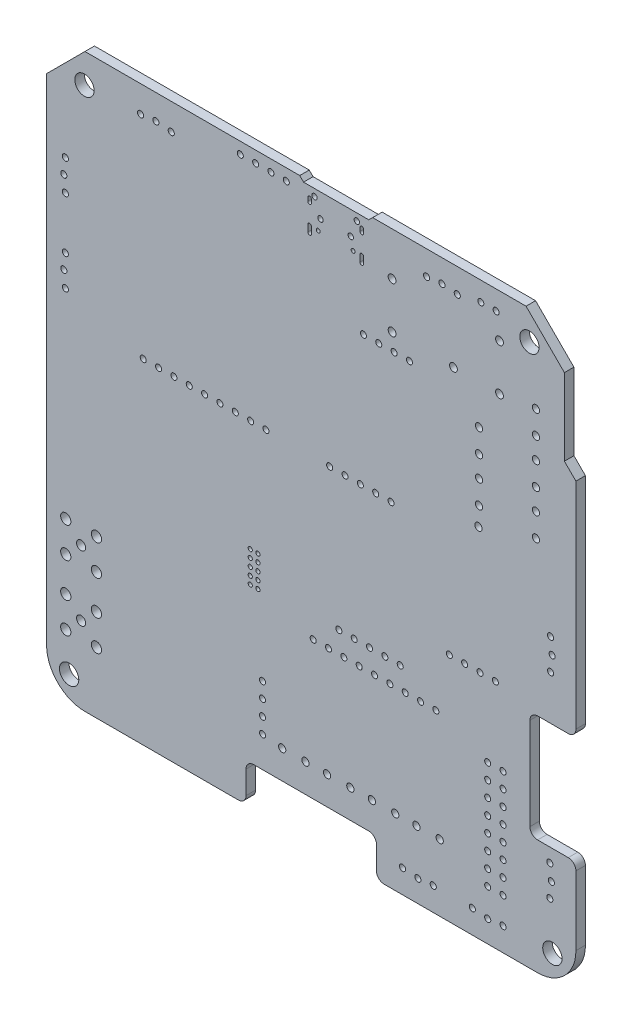
from build123d import *

# Parameters (mm, degrees)
SKETCH1_R           = 0.508
SKETCH1_R_2         = 1.6
SKETCH1_R_3         = 0.5
SKETCH1_R_4         = 0.6477
SKETCH1_R_5         = 0.6
SKETCH1_R_6         = 0.45
SKETCH1_R_7         = 0.4445
SKETCH1_R_8         = 0.325
SKETCH1_R_9         = 0.85
SKETCH1_R_10        = 0.75
SKETCH1_R_11        = 0.35
BOSS_EXTRUDE1_DEPTH = 1.5748


with BuildPart() as part:
    # Sketch1 → Boss-Extrude1 (new body)
    with BuildSketch(Plane.XY.offset(1.5748)):
        with BuildLine():
            Line((-37.465, -47.3075), (-12.065, -47.3075))
            ThreePointArc((-12.065, -47.3075), (-11.166974388, -46.935525612), (-10.795, -46.0375))
            Line((-10.795, -46.0375), (-10.795, -42.2275))
            ThreePointArc((-10.795, -42.2275), (-10.423025612, -41.329474388), (-9.525, -40.9575))
            Line((-9.525, -40.9575), (9.525, -40.9575))
            ThreePointArc((9.525, -40.9575), (10.423025612, -41.329474388), (10.795, -42.2275))
            Line((10.795, -42.2275), (10.795, -46.0375))
            ThreePointArc((10.795, -46.0375), (11.166974388, -46.935525612), (12.065, -47.3075))
            Line((12.065, -47.3075), (37.465, -47.3075))
            ThreePointArc((37.465, -47.3075), (41.955128061, -45.447628061), (43.815, -40.9575))
            Line((43.815, -40.9575), (43.815, -29.5275))
            ThreePointArc((43.815, -29.5275), (43.443025612, -28.629474388), (42.545, -28.2575))
            Line((42.545, -28.2575), (37.465, -28.2575))
            ThreePointArc((37.465, -28.2575), (36.566974388, -27.885525612), (36.195, -26.9875))
            Line((36.195, -26.9875), (36.195, -11.7475))
            ThreePointArc((36.195, -11.7475), (36.566974388, -10.849474388), (37.465, -10.4775))
            Line((37.465, -10.4775), (42.545, -10.4775))
            ThreePointArc((42.545, -10.4775), (43.443025612, -10.105525612), (43.815, -9.2075))
            Line((43.815, -9.2075), (43.815, 26.3525))
            Line((43.815, 26.3525), (41.91, 28.2575))
            Line((41.91, 28.2575), (41.91, 40.9575))
            Line((41.91, 40.9575), (35.56, 47.3075))
            Line((35.56, 47.3075), (10.16, 47.3075))
            Line((10.16, 47.3075), (9.525, 46.6725))
            Line((9.525, 46.6725), (-1.27, 46.6725))
            Line((-1.27, 46.6725), (-1.905, 47.3075))
            Line((-1.905, 47.3075), (-37.465, 47.3075))
            Line((-37.465, 47.3075), (-43.815, 40.9575))
            Line((-43.815, 40.9575), (-43.815, -40.9575))
            ThreePointArc((-43.815, -40.9575), (-41.955128061, -45.447628061), (-37.465, -47.3075))
        make_face()
        with Locations(Location((39.497, -35.6235, 0), (0, 0, 180))):
            Circle(SKETCH1_R, mode=Mode.SUBTRACT)
        with Locations(Location((39.9161, -43.2816, 0), (0, 0, 180))):
            Circle(SKETCH1_R_2, mode=Mode.SUBTRACT)
        with Locations(Location((39.751, -33.0835, 0), (0, 0, 180))):
            Circle(SKETCH1_R, mode=Mode.SUBTRACT)
        with Locations(Location((39.497, -30.5435, 0), (0, 0, 180))):
            Circle(SKETCH1_R, mode=Mode.SUBTRACT)
        with Locations(Location((39.624, -3.1115, 0), (0, 0, 180))):
            Circle(SKETCH1_R, mode=Mode.SUBTRACT)
        with Locations(Location((39.878, -0.5715, 0), (0, 0, 180))):
            Circle(SKETCH1_R, mode=Mode.SUBTRACT)
        with Locations(Location((39.624, 1.9685, 0), (0, 0, 180))):
            Circle(SKETCH1_R, mode=Mode.SUBTRACT)
        with Locations(Location((-40.0839, -43.2816, 0), (0, 0, 180))):
            Circle(SKETCH1_R_2, mode=Mode.SUBTRACT)
        with Locations(Location((15.113, -43.434, 0), (0, 0, 180))):
            Circle(SKETCH1_R, mode=Mode.SUBTRACT)
        with Locations(Location((20.193, -43.434, 0), (0, 0, 180))):
            Circle(SKETCH1_R, mode=Mode.SUBTRACT)
        with Locations(Location((17.653, -43.688, 0), (0, 0, 180))):
            Circle(SKETCH1_R, mode=Mode.SUBTRACT)
        with Locations(Location((26.67, -43.434, 0), (0, 0, 180))):
            Circle(SKETCH1_R, mode=Mode.SUBTRACT)
        with Locations(Location((29.21, -39.0525, 0), (0, 0, 180))):
            Circle(SKETCH1_R_3, mode=Mode.SUBTRACT)
        with Locations(Location((31.75, -39.0525, 0), (0, 0, 180))):
            Circle(SKETCH1_R_3, mode=Mode.SUBTRACT)
        with Locations(Location((31.75, -43.434, 0), (0, 0, 180))):
            Circle(SKETCH1_R, mode=Mode.SUBTRACT)
        with Locations(Location((29.21, -43.688, 0), (0, 0, 180))):
            Circle(SKETCH1_R, mode=Mode.SUBTRACT)
        with Locations(Location((-37.5439, 42.4434, 0), (0, 0, 180))):
            Circle(SKETCH1_R_2, mode=Mode.SUBTRACT)
        with Locations(Location((-28.2575, 42.926, 0), (0, 0, 180))):
            Circle(SKETCH1_R, mode=Mode.SUBTRACT)
        with Locations(Location((-11.7475, 45.4025, 0), (0, 0, 180))):
            Circle(SKETCH1_R_3, mode=Mode.SUBTRACT)
        with Locations(Location((-23.1775, 42.926, 0), (0, 0, 180))):
            Circle(SKETCH1_R, mode=Mode.SUBTRACT)
        with Locations(Location((-25.7175, 43.18, 0), (0, 0, 180))):
            Circle(SKETCH1_R, mode=Mode.SUBTRACT)
        with Locations(Location((36.1161, 42.4434, 0), (0, 0, 180))):
            Circle(SKETCH1_R_2, mode=Mode.SUBTRACT)
        with Locations(Location((31.1623, 40.147404, 0), (0, 0, 180))):
            Circle(SKETCH1_R_4, mode=Mode.SUBTRACT)
        with Locations(Location((30.607, 44.1325, 0), (0, 0, 180))):
            Circle(SKETCH1_R_3, mode=Mode.SUBTRACT)
        with Locations(Location((28.067, 44.1325, 0), (0, 0, 180))):
            Circle(SKETCH1_R_3, mode=Mode.SUBTRACT)
        with Locations(Location((31.1623, 32.527404, 0), (0, 0, 180))):
            Circle(SKETCH1_R_4, mode=Mode.SUBTRACT)
        with Locations(Location((37.1981, 33.407404, 0), (0, 0, 180))):
            Circle(SKETCH1_R_5, mode=Mode.SUBTRACT)
        with Locations(Location((-9.2075, 45.4025, 0), (0, 0, 180))):
            Circle(SKETCH1_R_3, mode=Mode.SUBTRACT)
        with Locations(Location((19.0941, 43.301404, 0), (0, 0, 180))):
            Circle(SKETCH1_R, mode=Mode.SUBTRACT)
        with Locations(Location((24.1741, 43.301404, 0), (0, 0, 180))):
            Circle(SKETCH1_R, mode=Mode.SUBTRACT)
        with Locations(Location((21.6341, 43.555404, 0), (0, 0, 180))):
            Circle(SKETCH1_R, mode=Mode.SUBTRACT)
        with Locations(Location((23.5423, 32.527404, 0), (0, 0, 180))):
            Circle(SKETCH1_R_4, mode=Mode.SUBTRACT)
        with Locations(Location((6.5386, 42.8041, 0), (0, 0, 180))):
            Circle(SKETCH1_R_6, mode=Mode.SUBTRACT)
        with Locations(Location((7.5386, 45.5041, 0), (0, 0, 180))):
            Circle(SKETCH1_R_7, mode=Mode.SUBTRACT)
        with Locations(Location((13.3823, 40.147404, 0), (0, 0, 180))):
            Circle(SKETCH1_R_4, mode=Mode.SUBTRACT)
        with Locations(Location((6.9366, 40.9257, 0), (0, 0, 180))):
            Circle(SKETCH1_R_8, mode=Mode.SUBTRACT)
        with Locations(Location((13.3823, 32.527404, 0), (0, 0, 180))):
            Circle(SKETCH1_R_4, mode=Mode.SUBTRACT)
        with Locations(Location((1.1566, 40.9257, 0), (0, 0, 180))):
            Circle(SKETCH1_R_8, mode=Mode.SUBTRACT)
        with Locations(Location((0.5386, 45.5041, 0), (0, 0, 180))):
            Circle(SKETCH1_R_7, mode=Mode.SUBTRACT)
        with Locations(Location((1.5386, 42.8041, 0), (0, 0, 180))):
            Circle(SKETCH1_R_6, mode=Mode.SUBTRACT)
        with Locations(Location((-4.1275, 45.4025, 0), (0, 0, 180))):
            Circle(SKETCH1_R_3, mode=Mode.SUBTRACT)
        with Locations(Location((-6.6675, 45.4025, 0), (0, 0, 180))):
            Circle(SKETCH1_R_3, mode=Mode.SUBTRACT)
        with Locations(Location((-40.64, -32.0675, 0), (0, 0, 180))):
            Circle(SKETCH1_R_9, mode=Mode.SUBTRACT)
        with Locations(Location((-38.1, -34.6075, 0), (0, 0, 180))):
            Circle(SKETCH1_R_10, mode=Mode.SUBTRACT)
        with Locations(Location((-40.64, -37.1475, 0), (0, 0, 180))):
            Circle(SKETCH1_R_9, mode=Mode.SUBTRACT)
        with Locations(Location((31.75, -28.8925, 0), (0, 0, 180))):
            Circle(SKETCH1_R_3, mode=Mode.SUBTRACT)
        with Locations(Location((-8.0645, -28.2575, 0), (0, 0, 180))):
            Circle(SKETCH1_R_3, mode=Mode.SUBTRACT)
        with Locations(Location((29.21, -28.8925, 0), (0, 0, 180))):
            Circle(SKETCH1_R_3, mode=Mode.SUBTRACT)
        with Locations(Location((31.75, -36.5125, 0), (0, 0, 180))):
            Circle(SKETCH1_R_3, mode=Mode.SUBTRACT)
        with Locations(Location((-8.0645, -33.3375, 0), (0, 0, 180))):
            Circle(SKETCH1_R_3, mode=Mode.SUBTRACT)
        with Locations(Location((31.75, -33.9725, 0), (0, 0, 180))):
            Circle(SKETCH1_R_3, mode=Mode.SUBTRACT)
        with Locations(Location((-8.0645, -30.7975, 0), (0, 0, 180))):
            Circle(SKETCH1_R_3, mode=Mode.SUBTRACT)
        with Locations(Location((29.21, -31.4325, 0), (0, 0, 180))):
            Circle(SKETCH1_R_3, mode=Mode.SUBTRACT)
        with Locations(Location((31.75, -31.4325, 0), (0, 0, 180))):
            Circle(SKETCH1_R_3, mode=Mode.SUBTRACT)
        with Locations(Location((-35.56, -32.0675, 0), (0, 0, 180))):
            Circle(SKETCH1_R_9, mode=Mode.SUBTRACT)
        with Locations(Location((-35.56, -37.1475, 0), (0, 0, 180))):
            Circle(SKETCH1_R_9, mode=Mode.SUBTRACT)
        with Locations(Location((13.9013, -36.2585, 0), (0, 0, 180))):
            Circle(SKETCH1_R_5, mode=Mode.SUBTRACT)
        with Locations(Location((21.2673, -36.2585, 0), (0, 0, 180))):
            Circle(SKETCH1_R_5, mode=Mode.SUBTRACT)
        with Locations(Location((17.4117, -36.2585, 0), (0, 0, 180))):
            Circle(SKETCH1_R_5, mode=Mode.SUBTRACT)
        with Locations(Location((29.21, -36.5125, 0), (0, 0, 180))):
            Circle(SKETCH1_R_3, mode=Mode.SUBTRACT)
        with Locations(Location((29.21, -33.9725, 0), (0, 0, 180))):
            Circle(SKETCH1_R_3, mode=Mode.SUBTRACT)
        with Locations(Location((6.4718, -36.2585, 0), (0, 0, 180))):
            Circle(SKETCH1_R_5, mode=Mode.SUBTRACT)
        with Locations(Location((10.0457, -36.2585, 0), (0, 0, 180))):
            Circle(SKETCH1_R_5, mode=Mode.SUBTRACT)
        with Locations(Location((-0.9577, -36.2585, 0), (0, 0, 180))):
            Circle(SKETCH1_R_5, mode=Mode.SUBTRACT)
        with Locations(Location((2.6162, -36.2585, 0), (0, 0, 180))):
            Circle(SKETCH1_R_5, mode=Mode.SUBTRACT)
        with Locations(Location((-4.8133, -36.2585, 0), (0, 0, 180))):
            Circle(SKETCH1_R_5, mode=Mode.SUBTRACT)
        with Locations(Location((-8.0645, -35.8775, 0), (0, 0, 180))):
            Circle(SKETCH1_R_3, mode=Mode.SUBTRACT)
        with Locations(Location((37.1981, 29.551804, 0), (0, 0, 180))):
            Circle(SKETCH1_R_5, mode=Mode.SUBTRACT)
        with Locations(Location((30.48, -9.017, 0), (0, 0, 180))):
            Circle(SKETCH1_R_3, mode=Mode.SUBTRACT)
        with Locations(Location((31.75, -21.2725, 0), (0, 0, 180))):
            Circle(SKETCH1_R_3, mode=Mode.SUBTRACT)
        with Locations(Location((31.75, -23.8125, 0), (0, 0, 180))):
            Circle(SKETCH1_R_3, mode=Mode.SUBTRACT)
        with Locations(Location((31.75, -26.3525, 0), (0, 0, 180))):
            Circle(SKETCH1_R_3, mode=Mode.SUBTRACT)
        with Locations(Location((37.1981, 18.696204, 0), (0, 0, 180))):
            Circle(SKETCH1_R_5, mode=Mode.SUBTRACT)
        with Locations(Location((37.1981, 14.840604, 0), (0, 0, 180))):
            Circle(SKETCH1_R_5, mode=Mode.SUBTRACT)
        with Locations(Location((37.1981, 26.051804, 0), (0, 0, 180))):
            Circle(SKETCH1_R_5, mode=Mode.SUBTRACT)
        with Locations(Location((37.1981, 22.196204, 0), (0, 0, 180))):
            Circle(SKETCH1_R_5, mode=Mode.SUBTRACT)
        with Locations(Location((13.716, 29.7815, 0), (0, 0, 180))):
            Circle(SKETCH1_R_3, mode=Mode.SUBTRACT)
        with Locations(Location((16.256, 29.7815, 0), (0, 0, 180))):
            Circle(SKETCH1_R_3, mode=Mode.SUBTRACT)
        with Locations(Location((-40.7035, 30.48, 0), (0, 0, 180))):
            Circle(SKETCH1_R, mode=Mode.SUBTRACT)
        with Locations(Location((-40.9575, 27.94, 0), (0, 0, 180))):
            Circle(SKETCH1_R, mode=Mode.SUBTRACT)
        with Locations(Location((8.636, 29.7815, 0), (0, 0, 180))):
            Circle(SKETCH1_R_3, mode=Mode.SUBTRACT)
        with Locations(Location((11.176, 29.7815, 0), (0, 0, 180))):
            Circle(SKETCH1_R_3, mode=Mode.SUBTRACT)
        with Locations(Location((-40.7035, 25.4, 0), (0, 0, 180))):
            Circle(SKETCH1_R, mode=Mode.SUBTRACT)
        with Locations(Location((-40.9575, 14.2875, 0), (0, 0, 180))):
            Circle(SKETCH1_R, mode=Mode.SUBTRACT)
        with Locations(Location((-40.7035, 16.8275, 0), (0, 0, 180))):
            Circle(SKETCH1_R, mode=Mode.SUBTRACT)
        with Locations(Location((-40.7035, 11.7475, 0), (0, 0, 180))):
            Circle(SKETCH1_R, mode=Mode.SUBTRACT)
        with Locations(Location((3.048, 8.0645, 0), (0, 0, 180))):
            Circle(SKETCH1_R_3, mode=Mode.SUBTRACT)
        with Locations(Location((2.8575, -18.0975, 0), (0, 0, 180))):
            Circle(SKETCH1_R_3, mode=Mode.SUBTRACT)
        with Locations(Location((0.3175, -18.0975, 0), (0, 0, 180))):
            Circle(SKETCH1_R_3, mode=Mode.SUBTRACT)
        with Locations(Location((4.572, -14.5923, 0), (0, 0, 180))):
            Circle(SKETCH1_R_3, mode=Mode.SUBTRACT)
        with Locations(Location((-38.1, -23.8125, 0), (0, 0, 180))):
            Circle(SKETCH1_R_10, mode=Mode.SUBTRACT)
        with Locations(Location((-40.64, -26.3525, 0), (0, 0, 180))):
            Circle(SKETCH1_R_9, mode=Mode.SUBTRACT)
        with Locations(Location((-35.56, -26.3525, 0), (0, 0, 180))):
            Circle(SKETCH1_R_9, mode=Mode.SUBTRACT)
        with Locations(Location((-8.8265, -15.4305, 0), (0, 0, 180))):
            Circle(SKETCH1_R_11, mode=Mode.SUBTRACT)
        with Locations(Location((-10.0965, -15.4305, 0), (0, 0, 180))):
            Circle(SKETCH1_R_11, mode=Mode.SUBTRACT)
        with Locations(Location((-10.0965, -10.3505, 0), (0, 0, 180))):
            Circle(SKETCH1_R_11, mode=Mode.SUBTRACT)
        with Locations(Location((-10.0965, -11.6205, 0), (0, 0, 180))):
            Circle(SKETCH1_R_11, mode=Mode.SUBTRACT)
        with Locations(Location((-8.8265, -11.6205, 0), (0, 0, 180))):
            Circle(SKETCH1_R_11, mode=Mode.SUBTRACT)
        with Locations(Location((-8.8265, -10.3505, 0), (0, 0, 180))):
            Circle(SKETCH1_R_11, mode=Mode.SUBTRACT)
        with Locations(Location((-10.0965, -12.8905, 0), (0, 0, 180))):
            Circle(SKETCH1_R_11, mode=Mode.SUBTRACT)
        with Locations(Location((-8.8265, -12.8905, 0), (0, 0, 180))):
            Circle(SKETCH1_R_11, mode=Mode.SUBTRACT)
        with Locations(Location((-8.8265, -14.1605, 0), (0, 0, 180))):
            Circle(SKETCH1_R_11, mode=Mode.SUBTRACT)
        with Locations(Location((-10.0965, -14.1605, 0), (0, 0, 180))):
            Circle(SKETCH1_R_11, mode=Mode.SUBTRACT)
        with Locations(Location((-12.573, 8.0645, 0), (0, 0, 180))):
            Circle(SKETCH1_R_3, mode=Mode.SUBTRACT)
        with Locations(Location((-15.113, 8.0645, 0), (0, 0, 180))):
            Circle(SKETCH1_R_3, mode=Mode.SUBTRACT)
        with Locations(Location((-10.033, 8.0645, 0), (0, 0, 180))):
            Circle(SKETCH1_R_3, mode=Mode.SUBTRACT)
        with Locations(Location((-7.493, 8.0645, 0), (0, 0, 180))):
            Circle(SKETCH1_R_3, mode=Mode.SUBTRACT)
        with Locations(Location((-27.813, 8.0645, 0), (0, 0, 180))):
            Circle(SKETCH1_R_3, mode=Mode.SUBTRACT)
        with Locations(Location((-22.733, 8.0645, 0), (0, 0, 180))):
            Circle(SKETCH1_R_3, mode=Mode.SUBTRACT)
        with Locations(Location((-25.273, 8.0645, 0), (0, 0, 180))):
            Circle(SKETCH1_R_3, mode=Mode.SUBTRACT)
        with Locations(Location((-20.193, 8.0645, 0), (0, 0, 180))):
            Circle(SKETCH1_R_3, mode=Mode.SUBTRACT)
        with Locations(Location((-17.653, 8.0645, 0), (0, 0, 180))):
            Circle(SKETCH1_R_3, mode=Mode.SUBTRACT)
        with Locations(Location((-35.56, -21.2725, 0), (0, 0, 180))):
            Circle(SKETCH1_R_9, mode=Mode.SUBTRACT)
        with Locations(Location((-40.64, -21.2725, 0), (0, 0, 180))):
            Circle(SKETCH1_R_9, mode=Mode.SUBTRACT)
        with Locations(Location((7.9375, -18.0975, 0), (0, 0, 180))):
            Circle(SKETCH1_R_3, mode=Mode.SUBTRACT)
        with Locations(Location((10.4775, -18.0975, 0), (0, 0, 180))):
            Circle(SKETCH1_R_3, mode=Mode.SUBTRACT)
        with Locations(Location((5.3975, -18.0975, 0), (0, 0, 180))):
            Circle(SKETCH1_R_3, mode=Mode.SUBTRACT)
        with Locations(Location((7.112, -14.5923, 0), (0, 0, 180))):
            Circle(SKETCH1_R_3, mode=Mode.SUBTRACT)
        with Locations(Location((9.652, -14.5923, 0), (0, 0, 180))):
            Circle(SKETCH1_R_3, mode=Mode.SUBTRACT)
        with Locations(Location((8.128, 8.0645, 0), (0, 0, 180))):
            Circle(SKETCH1_R_3, mode=Mode.SUBTRACT)
        with Locations(Location((5.588, 8.0645, 0), (0, 0, 180))):
            Circle(SKETCH1_R_3, mode=Mode.SUBTRACT)
        with Locations(Location((10.668, 8.0645, 0), (0, 0, 180))):
            Circle(SKETCH1_R_3, mode=Mode.SUBTRACT)
        with Locations(Location((22.86, -9.017, 0), (0, 0, 180))):
            Circle(SKETCH1_R_3, mode=Mode.SUBTRACT)
        with Locations(Location((25.4, -9.017, 0), (0, 0, 180))):
            Circle(SKETCH1_R_3, mode=Mode.SUBTRACT)
        with Locations(Location((18.0975, -18.0975, 0), (0, 0, 180))):
            Circle(SKETCH1_R_3, mode=Mode.SUBTRACT)
        with Locations(Location((20.6375, -18.0975, 0), (0, 0, 180))):
            Circle(SKETCH1_R_3, mode=Mode.SUBTRACT)
        with Locations(Location((15.5575, -18.0975, 0), (0, 0, 180))):
            Circle(SKETCH1_R_3, mode=Mode.SUBTRACT)
        with Locations(Location((14.732, -14.5923, 0), (0, 0, 180))):
            Circle(SKETCH1_R_3, mode=Mode.SUBTRACT)
        with Locations(Location((12.192, -14.5923, 0), (0, 0, 180))):
            Circle(SKETCH1_R_3, mode=Mode.SUBTRACT)
        with Locations(Location((13.0175, -18.0975, 0), (0, 0, 180))):
            Circle(SKETCH1_R_3, mode=Mode.SUBTRACT)
        with Locations(Location((13.208, 8.0645, 0), (0, 0, 180))):
            Circle(SKETCH1_R_3, mode=Mode.SUBTRACT)
        with Locations(Location((27.94, -9.017, 0), (0, 0, 180))):
            Circle(SKETCH1_R_3, mode=Mode.SUBTRACT)
        with Locations(Location((29.21, -21.2725, 0), (0, 0, 180))):
            Circle(SKETCH1_R_3, mode=Mode.SUBTRACT)
        with Locations(Location((29.21, -23.8125, 0), (0, 0, 180))):
            Circle(SKETCH1_R_3, mode=Mode.SUBTRACT)
        with Locations(Location((29.21, -26.3525, 0), (0, 0, 180))):
            Circle(SKETCH1_R_3, mode=Mode.SUBTRACT)
        with Locations(Location((27.7721, 18.696204, 0), (0, 0, 180))):
            Circle(SKETCH1_R_5, mode=Mode.SUBTRACT)
        with Locations(Location((27.7721, 14.840604, 0), (0, 0, 180))):
            Circle(SKETCH1_R_5, mode=Mode.SUBTRACT)
        with Locations(Location((27.6821, 11.7485, 0), (0, 0, 180))):
            Circle(SKETCH1_R_5, mode=Mode.SUBTRACT)
        with Locations(Location((27.7721, 22.196204, 0), (0, 0, 180))):
            Circle(SKETCH1_R_5, mode=Mode.SUBTRACT)
        with Locations(Location((27.7721, 26.051804, 0), (0, 0, 180))):
            Circle(SKETCH1_R_5, mode=Mode.SUBTRACT)
        with BuildLine():
            Line((8.0666, 44.2757), (8.0666, 44.8757))
            ThreePointArc((8.0666, 44.8757), (8.3666, 45.1757), (8.6666, 44.8757))
            Line((8.6666, 44.8757), (8.6666, 44.2757))
            ThreePointArc((8.6666, 44.2757), (8.3666, 43.9757), (8.0666, 44.2757))
        make_face(mode=Mode.SUBTRACT)
        with BuildLine():
            Line((8.0666, 39.8757), (8.0666, 40.9757))
            ThreePointArc((8.0666, 40.9757), (8.3666, 41.2757), (8.6666, 40.9757))
            Line((8.6666, 40.9757), (8.6666, 39.8757))
            ThreePointArc((8.6666, 39.8757), (8.3666, 39.5757), (8.0666, 39.8757))
        make_face(mode=Mode.SUBTRACT)
        with BuildLine():
            Line((-0.5734, 39.8757), (-0.5734, 40.9757))
            ThreePointArc((-0.5734, 40.9757), (-0.2734, 41.2757), (0.0266, 40.9757))
            Line((0.0266, 40.9757), (0.0266, 39.8757))
            ThreePointArc((0.0266, 39.8757), (-0.2734, 39.5757), (-0.5734, 39.8757))
        make_face(mode=Mode.SUBTRACT)
        with BuildLine():
            Line((-0.5734, 44.2757), (-0.5734, 44.8757))
            ThreePointArc((-0.5734, 44.8757), (-0.2734, 45.1757), (0.0266, 44.8757))
            Line((0.0266, 44.8757), (0.0266, 44.2757))
            ThreePointArc((0.0266, 44.2757), (-0.2734, 43.9757), (-0.5734, 44.2757))
        make_face(mode=Mode.SUBTRACT)
    extrude(amount=-BOSS_EXTRUDE1_DEPTH)


solid = part.part
